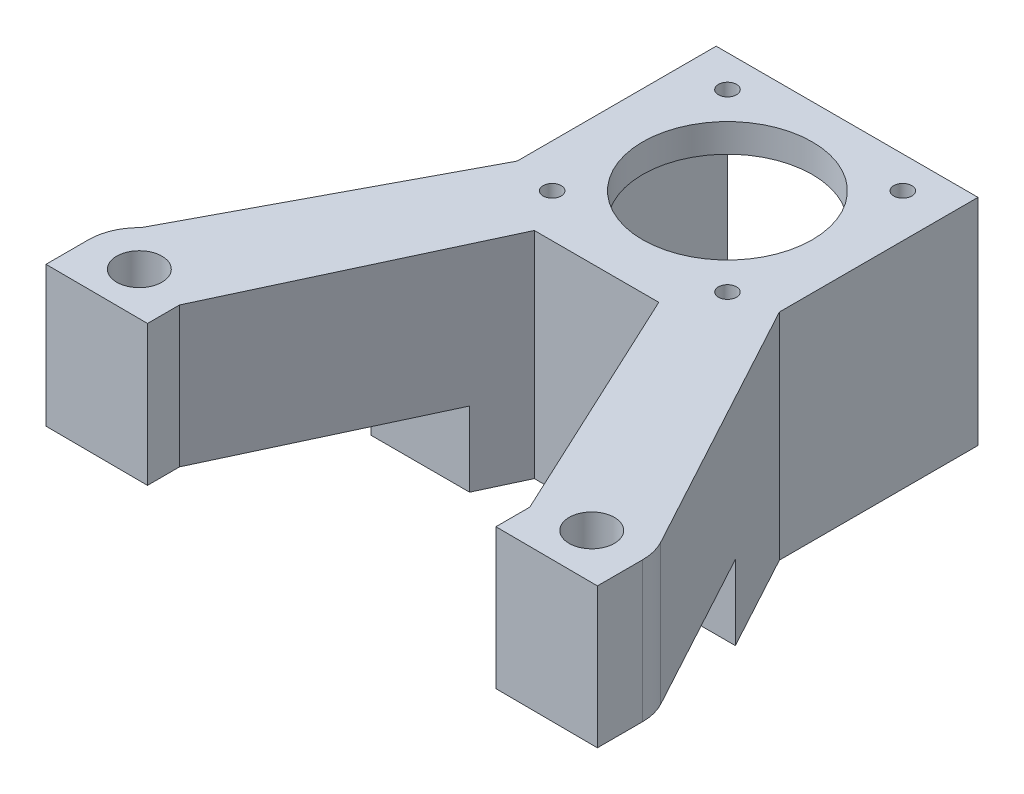
from build123d import *

# Parameters (mm, degrees)
SKETCH_6_W          = 42.3
SKETCH_6_H          = 42.3
SKETCH_6_R          = 1.6
SKETCH_6_R_2        = 15
EXTRUDE_1_DEPTH     = 5
SKETCH_7_R          = 4
EXTRUDE_5_DEPTH     = 38
EXTRUDE_START       = 38
SKETCH_7_7_R        = 4
EXTRUDE_7_DEPTH     = 38
SKETCH_7_8_R        = 4
EXTRUDE_8_DEPTH     = 38
SKETCH_12_W         = 2
SKETCH_12_H         = 44.3
EXTRUDE_11_DEPTH    = 38
SKETCH_14_W         = 44.3
SKETCH_14_H         = 2
EXTRUDE_12_DEPTH    = 38
SKETCH_15_W         = 2
SKETCH_15_H         = 42.3
EXTRUDE_13_DEPTH    = 38
CUT_EXTRUDE_1_DEPTH = 13.2


with BuildPart() as part:
    # 草图6 → 凸台-拉伸1 (new body)
    with BuildSketch(Plane(origin=(0, 0, 0), x_dir=(1, 0, 0), z_dir=(0, 1, 0))):
        Rectangle(SKETCH_6_W, SKETCH_6_H)
        with Locations(Location((15.5, 15.5, 0), (0, 0, 270))):
            Circle(SKETCH_6_R, mode=Mode.SUBTRACT)
        with Locations(Location((-15.5, 15.5, 0), (0, 0, 270))):
            Circle(SKETCH_6_R, mode=Mode.SUBTRACT)
        with Locations(Location((-15.5, -15.5, 0), (0, 0, 270))):
            Circle(SKETCH_6_R, mode=Mode.SUBTRACT)
        with Locations(Location((15.5, -15.5, 0), (0, 0, 270))):
            Circle(SKETCH_6_R, mode=Mode.SUBTRACT)
        with Locations(Location((0, 0, 0), (0, 0, 270))):
            Circle(SKETCH_6_R_2, mode=Mode.SUBTRACT)
    extrude(amount=EXTRUDE_1_DEPTH)

    # 草图7 → 凸台-拉伸5 (add)
    # profile 1 of 2: a face of its own
    with BuildSketch(Plane(origin=(0, 5, 0), x_dir=(1, 0, 0), z_dir=(0, 1, 0))):
        with BuildLine():
            Line((49, -72), (49, -64))
            ThreePointArc((49, -64), (48.724429591, -61.789948347), (47.914593709, -59.715235547))
            Line((47.914593709, -59.715235547), (21.15, -10.277072187))
            Line((21.15, -10.277072187), (21.15, -21.15))
            Line((21.15, -21.15), (10.070005019, -21.15))
            Line((10.070005019, -21.15), (30.963898233, -65.919418373))
            Line((30.963898233, -65.919418373), (30.963898233, -71.907979073))
            Line((30.963898233, -71.907979073), (49, -72))
        make_face()
        with Locations(Location((40, -64, 0), (0, 0, 270))):
            Circle(SKETCH_7_R, mode=Mode.SUBTRACT)
    # profile 2 of 2: a face of its own
    with BuildSketch(Plane(origin=(0, 5, 0), x_dir=(1, 0, 0), z_dir=(0, 1, 0))):
        with BuildLine():
            Line((-30.963898233, -65.919418373), (-10.070005019, -21.15))
            Line((-10.070005019, -21.15), (-21.15, -21.15))
            Line((-21.15, -21.15), (-21.15, -10.282583808))
            Line((-21.15, -10.282583808), (-46.202269248, -57.478354795))
            ThreePointArc((-46.202269248, -57.478354795), (-48.271046585, -60.45179082), (-49, -64))
            Line((-49, -64), (-49, -71.5))
            Line((-49, -71.5), (-30.963898233, -71.592020927))
            Line((-30.963898233, -71.592020927), (-30.963898233, -65.919418373))
        make_face()
        with Locations(Location((-40, -64, 0), (0, 0, 270))):
            Circle(SKETCH_7_R, mode=Mode.SUBTRACT)
    extrude(amount=-EXTRUDE_5_DEPTH)

    # 草图7<7> → 凸台-拉伸7 (add)
    with BuildSketch(Plane(origin=(0, 5, 0), x_dir=(1, 0, 0), z_dir=(0, 1, 0)).offset(EXTRUDE_START)):
        with Locations(Location((-40, -64, 0), (0, 0, 270))):
            Circle(SKETCH_7_7_R)
        with Locations(Location((40, -64, 0), (0, 0, 270))):
            Circle(SKETCH_7_7_R)
    extrude(amount=-EXTRUDE_7_DEPTH)


with BuildPart() as extrude_7_kept_piece:
    # of the separate pieces the step leaves, the one the design keeps (extrude_7_pieces_kept)
    add(part.part.solids().sort_by_distance((-10.070005019, 0, 21.15))[0])

    # 草图7<8> → 凸台-拉伸8 (add)
    with BuildSketch(Plane(origin=(0, 5, 0), x_dir=(1, 0, 0), z_dir=(0, 1, 0))):
        with Locations(Location((-40, -64, 0), (0, 0, 270))):
            Circle(SKETCH_7_8_R)
        with Locations(Location((40, -64, 0), (0, 0, 270))):
            Circle(SKETCH_7_8_R)
    extrude(amount=EXTRUDE_8_DEPTH)


with BuildPart() as extrude_8_kept_piece:
    # of the separate pieces the step leaves, the one the design keeps (extrude_8_pieces_kept)
    add(extrude_7_kept_piece.part.solids().sort_by_distance((-10.070005019, 0, 21.15))[0])

    # 草图12 → 凸台-拉伸11 (add)
    with BuildSketch(Plane(origin=(0, 5, 0), x_dir=(1, 0, 0), z_dir=(0, 1, 0))):
        with Locations((22.15, -1)):
            Rectangle(SKETCH_12_W, SKETCH_12_H)
    extrude(amount=-EXTRUDE_11_DEPTH)

    # 草图14 → 凸台-拉伸12 (add)
    with BuildSketch(Plane(origin=(0, 5, 0), x_dir=(1, 0, 0), z_dir=(0, 1, 0))):
        with Locations((-1, -22.15)):
            Rectangle(SKETCH_14_W, SKETCH_14_H)
    extrude(amount=-EXTRUDE_12_DEPTH)

    # 草图15 → 凸台-拉伸13 (add)
    with BuildSketch(Plane(origin=(0, 5, 0), x_dir=(1, 0, 0), z_dir=(0, 1, 0))):
        with Locations((-22.15, 0)):
            Rectangle(SKETCH_15_W, SKETCH_15_H)
    extrude(amount=-EXTRUDE_13_DEPTH)

    # 草图17 → 切除-拉伸1 (cut)
    with BuildSketch(Plane.XZ.offset(33)):
        Polygon((62.040525686, 30.953335803), (-8.604799232, 30.953335803), (-61.83718559, 30.953335803), (-61.83718559, 85.06296978), (-8.604799232, 85.06296978), (62.040525686, 85.06296978), align=None)
    extrude(amount=-CUT_EXTRUDE_1_DEPTH, mode=Mode.SUBTRACT)


solid = extrude_8_kept_piece.part
